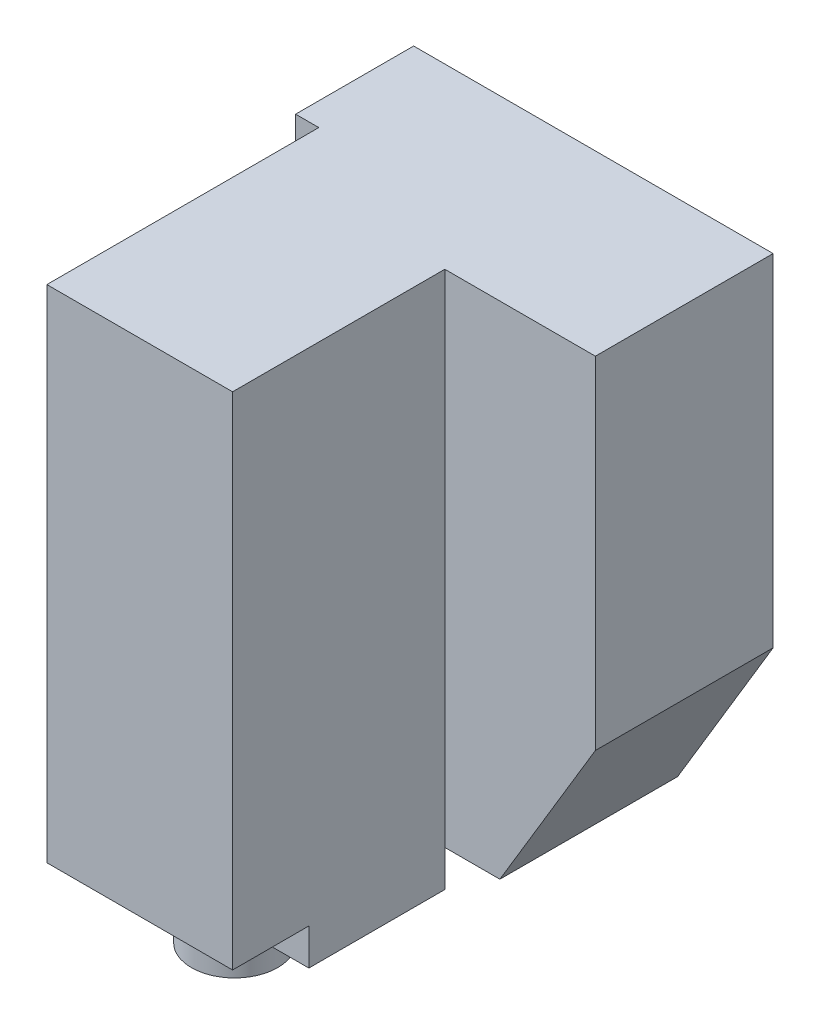
from build123d import *

# Parameters (mm, degrees)
SKETCH1_W           = 280
SKETCH1_H           = 755
BOSS_EXTRUDE1_DEPTH = 588
SKETCH4_R           = 81
BOSS_EXTRUDE2_DEPTH = 20
BOSS_EXTRUDE3_START = 20
SKETCH4_3_R         = 65
BOSS_EXTRUDE3_DEPTH = 106
BOSS_EXTRUDE4_START = 126
SKETCH4_4_R         = 37
BOSS_EXTRUDE4_DEPTH = 13
BOSS_EXTRUDE5_DEPTH = 268
BOSS_EXTRUDE6_DEPTH = 178
SKETCH7_W           = 55
SKETCH7_H           = 205
BOSS_EXTRUDE7_DEPTH = 55


with BuildPart() as part:
    # Sketch1 → Boss-Extrude1 (new body)
    with BuildSketch(Plane.XY):
        with Locations((-140, 377.5)):
            Rectangle(SKETCH1_W, SKETCH1_H)
    extrude(amount=BOSS_EXTRUDE1_DEPTH)

    # Sketch4 → Boss-Extrude2 (add)
    with BuildSketch(Plane.XZ):
        with Locations(Location((-160, 425, 0), (0, 0, 90))):
            Circle(SKETCH4_R)
    extrude(amount=BOSS_EXTRUDE2_DEPTH)

    # Sketch4<3> → Boss-Extrude3 (add)
    with BuildSketch(Plane.XZ.offset(BOSS_EXTRUDE3_START)):
        with Locations(Location((-160, 425, 0), (0, 0, 270))):
            Circle(SKETCH4_3_R)
    extrude(amount=BOSS_EXTRUDE3_DEPTH)

    # Sketch4<4> → Boss-Extrude4 (add)
    with BuildSketch(Plane.XZ.offset(BOSS_EXTRUDE4_START)):
        with Locations(Location((-160, 425, 0), (0, 0, 90))):
            Circle(SKETCH4_4_R)
    extrude(amount=BOSS_EXTRUDE4_DEPTH)

    # Sketch5 → Boss-Extrude5 (add)
    with BuildSketch(Plane(origin=(0, 0, 268), x_dir=(-1, 0, 0), z_dir=(0, 0, -1))):
        Polygon((0, 0), (-83, 0), (-227, 240.133296317), (-227, 755), (0, 755), align=None)
    extrude(amount=BOSS_EXTRUDE5_DEPTH)

    # Sketch6 → Boss-Extrude6 (add)
    with BuildSketch(Plane.XY.offset(178)):
        Polygon((-280, 0), (0, 0), (0, -70), (-315, -70), (-315, 755), (-280, 755), align=None)
    extrude(amount=-BOSS_EXTRUDE6_DEPTH)

    # Sketch7 → Boss-Extrude7 (add)
    with BuildSketch(Plane.XZ):
        with Locations((-27.5, 370.5)):
            Rectangle(SKETCH7_W, SKETCH7_H)
    extrude(amount=BOSS_EXTRUDE7_DEPTH)


solid = part.part
